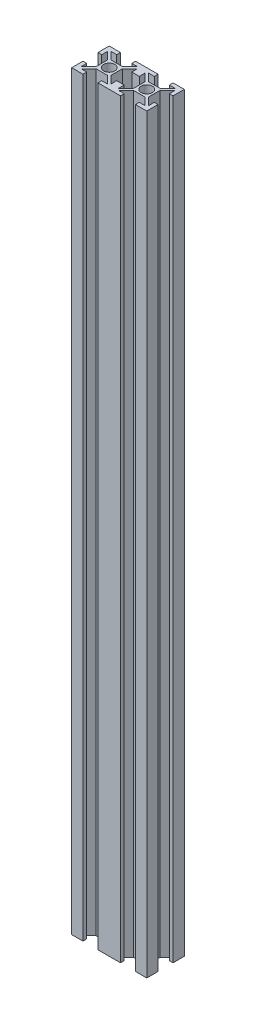
from build123d import *

# Parameters (mm, degrees)
F_2020_SKETCH_R     = 3
BOSS_EXTRUDE1_DEPTH = 400


with BuildPart() as part:
    # 2020 sketch → Boss-Extrude1 (new body)
    with BuildSketch(Plane(origin=(0, 0, 0), x_dir=(1, 0, 0), z_dir=(0, 1, 0))):
        Polygon((-4, 10), (-4, 8), (-7, 8), (-3, 4), (3, 4), (7, 8), (4, 8), (4, 10), (10, 10), (10, 4), (8, 4), (8, 7), (4, 3), (4, -3), (8, -7), (8, -4), (10, -4), (10, -10), (4, -10), (4, -8), (7, -8), (3, -4), (-3, -4), (-7, -8), (-4, -8), (-4, -10), (-10, -10), (-10, -4), (-8, -4), (-8, -7), (-4, -3), (-4, 3), (-8, 7), (-8, 4), (-10, 4), (-10, 10), align=None)
        with Locations(Location((0, 0, 0), (0, 0, 270))):
            Circle(F_2020_SKETCH_R, mode=Mode.SUBTRACT)
    boss_extrude1 = extrude(amount=BOSS_EXTRUDE1_DEPTH)

    # Mirror1: Boss-Extrude1 across plane
    add(boss_extrude1.mirror(Plane(origin=(10, 400, 4), x_dir=(0, 0, 1), z_dir=(1, 0, 0))))


solid = part.part
